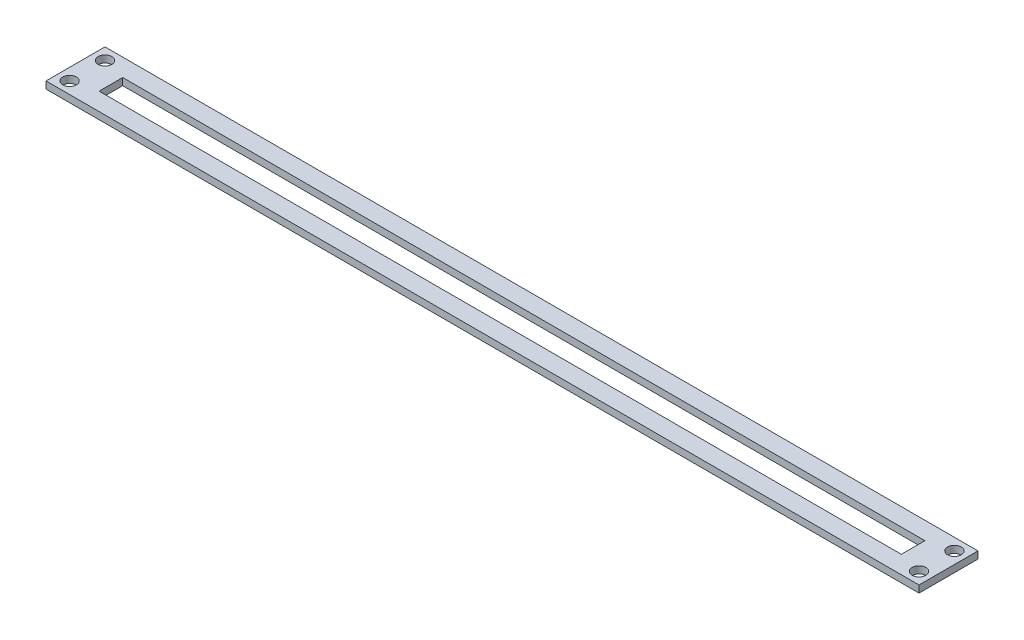
from build123d import *

# Parameters (mm, degrees)
ESQUISSE1_W          = 370
ESQUISSE1_H          = 25
ESQUISSE1_W_2        = 340
ESQUISSE1_H_2        = 10
BOSS_EXTRU_1_DEPTH   = 3
D_GAGEMENT_M51_D     = 5.8
D_GAGEMENT_M51_DEPTH = 4


with BuildPart() as part:
    # Esquisse1 → Boss.-Extru.1 (new body)
    with BuildSketch(Plane(origin=(0, 0, 0), x_dir=(1, 0, 0), z_dir=(0, 1, 0))):
        Rectangle(ESQUISSE1_W, ESQUISSE1_H)
        Rectangle(ESQUISSE1_W_2, ESQUISSE1_H_2, mode=Mode.SUBTRACT)
    extrude(amount=BOSS_EXTRU_1_DEPTH)

    # Dégagement M51
    with Locations(Plane(origin=(0, 3, 0), x_dir=(1, 0, 0), z_dir=(0, 1, 0))):
        with Locations((-180, 7.5), (-180, -7.5), (180, -7.5), (180, 7.5)):
            Hole(D_GAGEMENT_M51_D / 2, depth=D_GAGEMENT_M51_DEPTH)


solid = part.part
